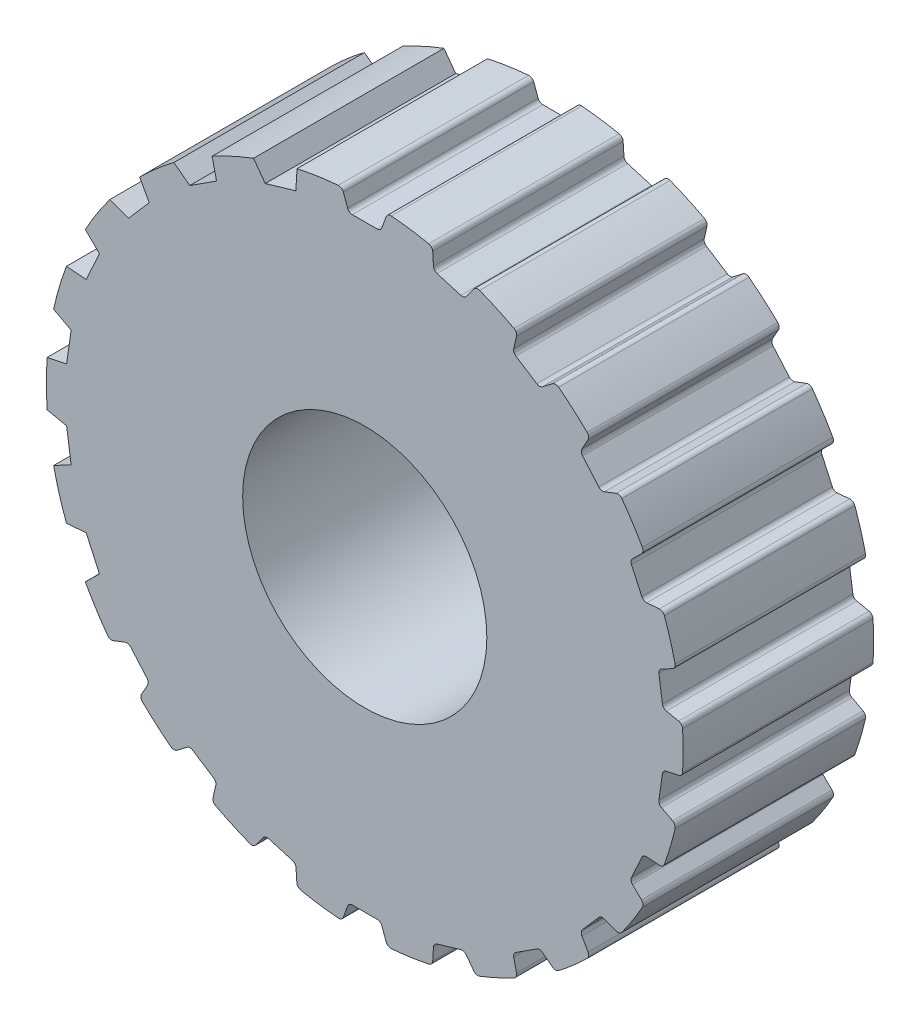
from build123d import *

# Parameters (mm, degrees)
BOSS_EXTRUDE1_DEPTH      = 7.25
BOSS_EXTRUDE1_DEPTH_BACK = 7.25
SKETCH7_R                = 32.597981913
CUT_EXTRUDE3_DEPTH       = 51.867542202
CUT_EXTRUDE3_DEPTH_BACK  = 51.867542202
SKETCH15_R               = 8.008120878
SKETCH15_R_2             = 2.25
BOSS_EXTRUDE2_DEPTH      = 5.5
SKETCH16_R               = 5
CUT_EXTRUDE4_DEPTH       = 3
BOSS_EXTRUDE3_START      = 7.5
SKETCH17_R               = 32.597981913
SKETCH17_R_2             = 5
BOSS_EXTRUDE3_DEPTH      = 7.5
CUT_EXTRUDE2_DEPTH       = 51.867542202
CUT_EXTRUDE2_DEPTH_BACK  = 51.867542202
FILLET2_R                = 0.51
BOSS_EXTRUDE4_START      = 2.5
SKETCH18_R               = 37.597981913
SKETCH18_R_2             = 5
BOSS_EXTRUDE4_DEPTH      = 2.5
BOSS_EXTRUDE5_START      = -2.5
SKETCH19_R               = 37.597981913
SKETCH19_R_2             = 19
BOSS_EXTRUDE5_DEPTH      = 2.5
FILLET3_R                = 0.5
CUT_EXTRUDE5_DEPTH       = 58.353870769
CUT_EXTRUDE5_DEPTH_BACK  = 58.353870769
SKETCH20_W               = 16.75
SKETCH20_H               = 75.195963826
SKETCH20_W_2             = 2.5
CUT_EXTRUDE6_DEPTH       = 49.32770796
CUT_EXTRUDE6_DEPTH_BACK  = 49.32770796
SKETCH21_R               = 12.5


with BuildPart() as part:
    # Sketch7 → Boss-Extrude1 (new, two sides: drawn at the far end of the back side and taken through both)
    with BuildSketch(Plane.XY.offset(-BOSS_EXTRUDE1_DEPTH_BACK)):
        Circle(SKETCH7_R)
    extrude(amount=BOSS_EXTRUDE1_DEPTH + BOSS_EXTRUDE1_DEPTH_BACK)

    # Sketch14 → Revolve1 (revolve)
    with BuildSketch(Plane(origin=(0, 0, 0), x_dir=(0, 0, -1), z_dir=(1, 0, 0))):
        with BuildLine():
            Line((-21.5, 0), (0, 0))
            Line((0, 0), (0, 19))
            Line((0, 19), (-7.25, 19))
            ThreePointArc((-7.25, 19), (-13.040017522, 12.386277742), (-21.5, 10))
            Line((-21.5, 10), (-21.5, 0))
        make_face()
    revolve(axis=Axis((0, 0, -36.129595921), (0, 0, 1)))

    # Sketch10 → Cut-Extrude3 (cut, two sides: drawn at the far end of the back side and taken through both)
    with BuildSketch(Plane.XY.offset(-CUT_EXTRUDE3_DEPTH_BACK)):
        with BuildLine():
            Line((2.2, 7.7), (-2.2, 7.7))
            Line((-2.2, 7.7), (-2.2, 5.796550698))
            ThreePointArc((-2.2, 5.796550698), (0, -6.2), (2.2, 5.796550698))
            Line((2.2, 5.796550698), (2.2, 7.7))
        make_face()
    extrude(amount=CUT_EXTRUDE3_DEPTH + CUT_EXTRUDE3_DEPTH_BACK, mode=Mode.SUBTRACT)

    # Sketch15 → Boss-Extrude2 (add)
    with BuildSketch(Plane(origin=(0, 0, -7.25), x_dir=(-1, 0, 0), z_dir=(0, 0, -1))):
        Circle(SKETCH15_R)
        Circle(SKETCH15_R_2, mode=Mode.SUBTRACT)
    extrude(amount=-BOSS_EXTRUDE2_DEPTH)

    # Sketch16 → Cut-Extrude4 (cut)
    with BuildSketch(Plane(origin=(0, 0, -7.25), x_dir=(-1, 0, 0), z_dir=(0, 0, -1))):
        Circle(SKETCH16_R)
    extrude(amount=-CUT_EXTRUDE4_DEPTH, mode=Mode.SUBTRACT)

    # Sketch17 → Boss-Extrude3 (add)
    with BuildSketch(Plane(origin=(0, 0, -7.25), x_dir=(-1, 0, 0), z_dir=(0, 0, -1)).offset(BOSS_EXTRUDE3_START)):
        Circle(SKETCH17_R)
        Circle(SKETCH17_R_2, mode=Mode.SUBTRACT)
    extrude(amount=-BOSS_EXTRUDE3_DEPTH)

    # Sketch8 → Cut-Extrude2 (cut, two sides: drawn at the far end of the back side and taken through both)
    with BuildSketch(Plane.XY.offset(-CUT_EXTRUDE2_DEPTH_BACK)):
        Polygon((-1.629816853, 30.604962707), (-2.35521652, 32.597981913), (2.35521652, 32.597981913), (1.629816853, 30.604962707), align=None)
        Polygon((7.058616577, 29.824419144), (6.92409909, 31.941075772), (11.443726495, 30.613993428), (10.186212214, 28.906074206), align=None)
        Polygon((15.175202871, 26.627678515), (15.642465371, 28.696493633), (19.605133807, 26.149841263), (17.917381241, 24.865387484), align=None)
        Polygon((22.062384479, 21.273721733), (23.093572137, 23.127092244), (26.178249775, 19.567184478), (24.196990599, 18.810254948), align=None)
        Polygon((27.162202906, 14.196294536), (28.673775031, 15.684071383), (30.630559634, 11.399310778), (28.516303684, 11.231227425), align=None)
        Polygon((30.061501193, 5.968767985), (31.930999202, 6.970420336), (32.601363718, 2.307932712), (30.525395437, 2.742312651), align=None)
        Polygon((30.525395437, -2.742312651), (32.601363718, -2.307932712), (31.930999202, -6.970420336), (30.061501193, -5.968767985), align=None)
        Polygon((28.516303684, -11.231227425), (30.630559634, -11.399310778), (28.673775031, -15.684071383), (27.162202906, -14.196294536), align=None)
        Polygon((24.196990599, -18.810254948), (26.178249775, -19.567184478), (23.093572137, -23.127092244), (22.062384479, -21.273721733), align=None)
        Polygon((17.917381241, -24.865387484), (19.605133807, -26.149841263), (15.642465371, -28.696493633), (15.175202871, -26.627678515), align=None)
        Polygon((10.186212214, -28.906074206), (11.443726495, -30.613993428), (6.92409909, -31.941075772), (7.058616577, -29.824419144), align=None)
        Polygon((1.629816853, -30.604962707), (2.35521652, -32.597981913), (-2.35521652, -32.597981913), (-1.629816853, -30.604962707), align=None)
        Polygon((-7.058616577, -29.824419144), (-6.92409909, -31.941075772), (-11.443726495, -30.613993428), (-10.186212214, -28.906074206), align=None)
        Polygon((-15.175202871, -26.627678515), (-15.642465371, -28.696493633), (-19.605133807, -26.149841263), (-17.917381241, -24.865387484), align=None)
        Polygon((-22.062384479, -21.273721733), (-23.093572137, -23.127092244), (-26.178249775, -19.567184478), (-24.196990599, -18.810254948), align=None)
        Polygon((-27.162202906, -14.196294536), (-28.673775031, -15.684071383), (-30.630559634, -11.399310778), (-28.516303684, -11.231227425), align=None)
        Polygon((-30.061501193, -5.968767985), (-31.930999202, -6.970420336), (-32.601363718, -2.307932712), (-30.525395437, -2.742312651), align=None)
        Polygon((-30.525395437, 2.742312651), (-32.601363718, 2.307932712), (-31.930999202, 6.970420336), (-30.061501193, 5.968767985), align=None)
        Polygon((-28.516303684, 11.231227425), (-30.630559634, 11.399310778), (-28.673775031, 15.684071383), (-27.162202906, 14.196294536), align=None)
        Polygon((-24.196990599, 18.810254948), (-26.178249775, 19.567184478), (-23.093572137, 23.127092244), (-22.062384479, 21.273721733), align=None)
        Polygon((-17.917381241, 24.865387484), (-19.605133807, 26.149841263), (-15.642465371, 28.696493633), (-15.175202871, 26.627678515), align=None)
        Polygon((-10.186212214, 28.906074206), (-11.443726495, 30.613993428), (-6.92409909, 31.941075772), (-7.058616577, 29.824419144), align=None)
    extrude(amount=CUT_EXTRUDE2_DEPTH + CUT_EXTRUDE2_DEPTH_BACK, mode=Mode.SUBTRACT)

    # Fillet2
    fillet2_edges = [part.edges().sort_by_distance(p)[0] for p in [
        (-26.095720432, -19.535654582, -3.75),
        (-23.050618019, -23.049890103, -3.75),
        (-19.534830481, -26.096337346, -3.75),
        (-15.623001554, -28.610317148, -3.75),
        (-11.391344743, -30.54285006, -3.75),
        (-6.929702415, -31.852906449, -3.75),
        (-2.325, -32.514962707, -3.75),
        (2.325, -32.514962707, -3.75),
        (6.929702415, -31.852906449, -3.75),
        (11.391344743, -30.54285006, -3.75),
        (15.623001554, -28.610317148, -3.75),
        (19.534830481, -26.096337346, -3.75),
        (23.050618019, -23.049890103, -3.75),
        (26.095720432, -19.535654582, -3.75),
        (28.610810501, -15.622098045, -3.75),
        (30.542490311, -11.392309266, -3.75),
        (31.85312527, -6.928696511, -3.75),
        (32.514889268, -2.326026807, -3.75),
        (32.514889268, 2.326026807, -3.75),
        (31.85312527, 6.928696511, -3.75),
        (30.542490311, 11.392309266, -3.75),
        (28.610810501, 15.622098045, -3.75),
        (26.095720432, 19.535654582, -3.75),
        (23.050618019, 23.049890103, -3.75),
        (19.534830481, 26.096337346, -3.75),
        (15.623001554, 28.610317148, -3.75),
        (11.391344743, 30.54285006, -3.75),
        (6.929702415, 31.852906449, -3.75),
        (2.325, 32.514962707, -3.75),
        (-24.196990599, -18.810254948, -3.75),
        (-22.062384479, -21.273721733, -3.75),
        (-17.917381241, -24.865387484, -3.75),
        (-15.175202871, -26.627678515, -3.75),
        (-10.186212214, -28.906074206, -3.75),
        (-7.058616577, -29.824419144, -3.75),
        (-1.629816853, -30.604962707, -3.75),
        (1.629816853, -30.604962707, -3.75),
        (7.058616577, -29.824419144, -3.75),
        (10.186212214, -28.906074206, -3.75),
        (15.175202871, -26.627678515, -3.75),
        (17.917381241, -24.865387484, -3.75),
        (22.062384479, -21.273721733, -3.75),
        (24.196990599, -18.810254948, -3.75),
        (27.162202906, -14.196294536, -3.75),
        (28.516303684, -11.231227425, -3.75),
        (30.061501193, -5.968767985, -3.75),
        (30.525395437, -2.742312651, -3.75),
        (30.525395437, 2.742312651, -3.75),
        (30.061501193, 5.968767985, -3.75),
        (28.516303684, 11.231227425, -3.75),
        (27.162202906, 14.196294536, -3.75),
        (24.196990599, 18.810254948, -3.75),
        (22.062384479, 21.273721733, -3.75),
        (17.917381241, 24.865387484, -3.75),
        (15.175202871, 26.627678515, -3.75),
        (10.186212214, 28.906074206, -3.75),
        (7.058616577, 29.824419144, -3.75),
        (1.629816853, 30.604962707, -3.75),
        (-1.629816853, 30.604962707, -3.75),
        (-2.325, 32.514962707, -3.75),
    ]]
    fillet(fillet2_edges, radius=FILLET2_R)

    # Sketch18 → Boss-Extrude4 (add)
    with BuildSketch(Plane(origin=(0, 0, -14.75), x_dir=(-1, 0, 0), z_dir=(0, 0, -1)).offset(BOSS_EXTRUDE4_START)):
        Circle(SKETCH18_R)
        Circle(SKETCH18_R_2, mode=Mode.SUBTRACT)
    extrude(amount=-BOSS_EXTRUDE4_DEPTH)

    # Sketch19 → Boss-Extrude5 (add)
    with BuildSketch(Plane.XY.offset(7.25).offset(BOSS_EXTRUDE5_START)):
        Circle(SKETCH19_R)
        Circle(SKETCH19_R_2, mode=Mode.SUBTRACT)
    extrude(amount=BOSS_EXTRUDE5_DEPTH)

    # Fillet3
    fillet3_edges = [part.edges().sort_by_distance(p)[0] for p in [
        (2.2, 5.796550698, 9.875),
        (-2.2, 5.796550698, 9.875),
        (2.2, 6.748275349, 21.5),
        (-2.2, 6.748275349, 21.5),
        (0, 7.7, 21.5),
        (0, -19, 7.25),
        (0, -10, 21.5),
        (0, -6.2, 21.5),
        (5, 0, -4.25),
        (2.25, 0, -4.25),
        (-2.2, 6.748275349, -1.75),
        (2.2, 6.748275349, -1.75),
        (-37.597981913, 0, 4.75),
        (37.597981913, 0, -14.75),
        (37.597981913, 0, -17.25),
        (-37.597981913, 0, 7.25),
        (0, 7.7, -1.75),
        (0, -6.2, -1.75),
        (5, 0, -17.25),
    ]]
    fillet(fillet3_edges, radius=FILLET3_R)

    # Sketch20 → Cut-Extrude5 (cut, two sides: drawn at the far end of the back side and taken through both)
    with BuildSketch(Plane(origin=(0, 0, 0), x_dir=(0, 0, -1), z_dir=(1, 0, 0)).offset(-CUT_EXTRUDE5_DEPTH_BACK)):
        with Locations((-13.125, 0)):
            Rectangle(SKETCH20_W, SKETCH20_H)
        with Locations((16, 0)):
            Rectangle(SKETCH20_W_2, SKETCH20_H)
    extrude(amount=CUT_EXTRUDE5_DEPTH + CUT_EXTRUDE5_DEPTH_BACK, mode=Mode.SUBTRACT)

    # Sketch21 → Cut-Extrude6 (cut, two sides: drawn at the far end of the back side and taken through both)
    with BuildSketch(Plane.XY.offset(-CUT_EXTRUDE6_DEPTH_BACK)):
        Circle(SKETCH21_R)
    extrude(amount=CUT_EXTRUDE6_DEPTH + CUT_EXTRUDE6_DEPTH_BACK, mode=Mode.SUBTRACT)


solid = part.part
